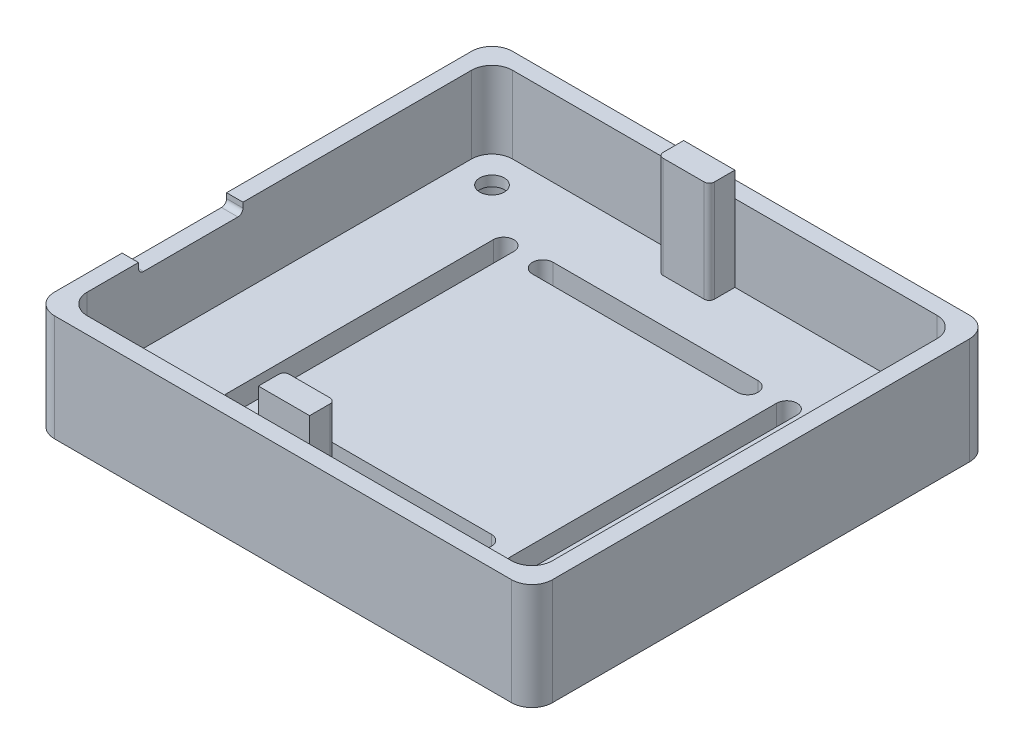
from build123d import *

# Parameters (mm, degrees)
EXTRUDE_1_DEPTH     = 10.4
CUT_EXTRUDE_1_DEPTH = 7.5
SKETCH_3_R          = 2.1
CUT_EXTRUDE_2_DEPTH = 1.9
SKETCH_4_R          = 1.2
CUT_EXTRUDE_3_DEPTH = 3.2
EXTRUDE_2_DEPTH     = 9.91
CUT_EXTRUDE_4_DEPTH = 10
CUT_EXTRUDE_5_DEPTH = 10


with BuildPart() as part:
    # 草图1 → 凸台-拉伸1 (new body)
    with BuildSketch(Plane(origin=(0, 0, 0), x_dir=(1, 0, 0), z_dir=(0, 1, 0))):
        with BuildLine():
            Line((-22.3, -22.35), (22.3, -22.35))
            ThreePointArc((22.3, -22.35), (23.714213562, -21.764213562), (24.3, -20.35))
            Line((24.3, -20.35), (24.3, 20.35))
            ThreePointArc((24.3, 20.35), (23.714213562, 21.764213562), (22.3, 22.35))
            Line((22.3, 22.35), (-22.3, 22.35))
            ThreePointArc((-22.3, 22.35), (-23.714213562, 21.764213562), (-24.3, 20.35))
            Line((-24.3, 20.35), (-24.3, -20.35))
            ThreePointArc((-24.3, -20.35), (-23.714213562, -21.764213562), (-22.3, -22.35))
        make_face()
    extrude(amount=EXTRUDE_1_DEPTH)

    # 草图2 → 切除-拉伸1 (cut)
    with BuildSketch(Plane(origin=(0, 10.4, 0), x_dir=(1, 0, 0), z_dir=(0, 1, 0))):
        with BuildLine():
            Line((-20.7, -20.75), (20.7, -20.75))
            ThreePointArc((20.7, -20.75), (22.114213562, -20.164213562), (22.7, -18.75))
            Line((22.7, -18.75), (22.7, 18.75))
            ThreePointArc((22.7, 18.75), (22.114213562, 20.164213562), (20.7, 20.75))
            Line((20.7, 20.75), (-20.7, 20.75))
            ThreePointArc((-20.7, 20.75), (-22.114213562, 20.164213562), (-22.7, 18.75))
            Line((-22.7, 18.75), (-22.7, -18.75))
            ThreePointArc((-22.7, -18.75), (-22.114213562, -20.164213562), (-20.7, -20.75))
        make_face()
    extrude(amount=-CUT_EXTRUDE_1_DEPTH, mode=Mode.SUBTRACT)

    # 草图3 → 切除-拉伸2 (cut)
    with BuildSketch(Plane.XZ):
        with Locations(Location((-19.5, -17.55, 0), (0, 0, 270))):
            Circle(SKETCH_3_R)
        with Locations(Location((-19.5, 17.55, 0), (0, 0, 270))):
            Circle(SKETCH_3_R)
        with Locations(Location((16.5, 17.55, 0), (0, 0, 270))):
            Circle(SKETCH_3_R)
    extrude(amount=-CUT_EXTRUDE_2_DEPTH, mode=Mode.SUBTRACT)

    # 草图4 → 切除-拉伸3 (cut)
    with BuildSketch(Plane.XZ):
        with Locations(Location((-19.5, 17.55, 0), (0, 0, 90))):
            Circle(SKETCH_4_R)
        with Locations(Location((-19.5, -17.55, 0), (0, 0, 270))):
            Circle(SKETCH_4_R)
        with Locations(Location((16.5, 17.55, 0), (0, 0, 270))):
            Circle(SKETCH_4_R)
    extrude(amount=-CUT_EXTRUDE_3_DEPTH, mode=Mode.SUBTRACT)

    # 草图5 → 凸台-拉伸2 (add)
    with BuildSketch(Plane(origin=(0, 2.9, 0), x_dir=(1, 0, 0), z_dir=(0, 1, 0))):
        with BuildLine():
            Line((-4, 20.75), (1, 20.75))
            Line((1, 20.75), (1, 18.75))
            ThreePointArc((1, 18.75), (0.853553391, 18.396446609), (0.5, 18.25))
            Line((0.5, 18.25), (-3.5, 18.25))
            ThreePointArc((-3.5, 18.25), (-3.853553391, 18.396446609), (-4, 18.75))
            Line((-4, 18.75), (-4, 20.75))
        make_face()
        with BuildLine():
            Line((-3.5, -18.25), (0.5, -18.25))
            ThreePointArc((0.5, -18.25), (0.853553391, -18.396446609), (1, -18.75))
            Line((1, -18.75), (1, -20.75))
            Line((1, -20.75), (-4, -20.75))
            Line((-4, -20.75), (-4, -18.75))
            ThreePointArc((-4, -18.75), (-3.853553391, -18.396446609), (-3.5, -18.25))
        make_face()
    extrude(amount=EXTRUDE_2_DEPTH)

    # 草图6 → 切除-拉伸4 (cut)
    with BuildSketch(Plane.XZ):
        with BuildLine():
            Line((-12.821321535, 13), (-12.821321535, -13))
            ThreePointArc((-12.821321535, -13), (-13.821321535, -14), (-14.821321535, -13))
            Line((-14.821321535, -13), (-14.821321535, 13))
            ThreePointArc((-14.821321535, 13), (-13.821321535, 14), (-12.821321535, 13))
        make_face()
        with BuildLine():
            Line((-10, -12), (10, -12))
            ThreePointArc((10, -12), (11, -13), (10, -14))
            Line((10, -14), (-10, -14))
            ThreePointArc((-10, -14), (-11, -13), (-10, -12))
        make_face()
        with BuildLine():
            Line((12.821321535, 13), (12.821321535, -13))
            ThreePointArc((12.821321535, -13), (13.821321535, -14), (14.821321535, -13))
            Line((14.821321535, -13), (14.821321535, 13))
            ThreePointArc((14.821321535, 13), (13.821321535, 14), (12.821321535, 13))
        make_face()
        with BuildLine():
            Line((-10, 12), (10, 12))
            ThreePointArc((10, 12), (11, 13), (10, 14))
            Line((10, 14), (-10, 14))
            ThreePointArc((-10, 14), (-11, 13), (-10, 12))
        make_face()
    extrude(amount=-CUT_EXTRUDE_4_DEPTH, mode=Mode.SUBTRACT)

    # 草图7 → 切除-拉伸5 (cut)
    with BuildSketch(Plane.ZY.offset(24.3)):
        with BuildLine():
            Line((3.55, 10.4), (13.75, 10.4))
            Line((13.75, 10.4), (13.75, 9.9))
            ThreePointArc((13.75, 9.9), (13.603553391, 9.546446609), (13.25, 9.4))
            Line((13.25, 9.4), (4.05, 9.4))
            ThreePointArc((4.05, 9.4), (3.696446609, 9.546446609), (3.55, 9.9))
            Line((3.55, 9.9), (3.55, 10.4))
        make_face()
    extrude(amount=-CUT_EXTRUDE_5_DEPTH, mode=Mode.SUBTRACT)


solid = part.part
